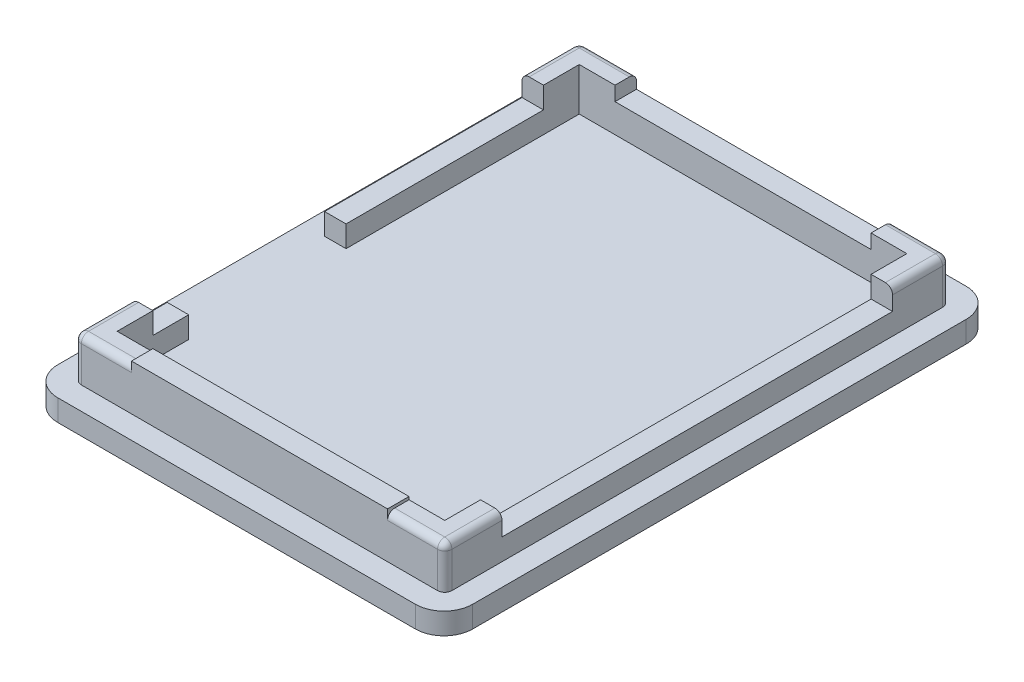
from build123d import *

# Parameters (mm, degrees)
SKETCH_1_W          = 29
SKETCH_1_H          = 38.5
EXTRUDE_2_DEPTH     = 4.5
SKETCH_3_W          = 29
SKETCH_3_H          = 38.5
SKETCH_3_W_2        = 25.9
SKETCH_3_H_2        = 35.3
CUT_EXTRUDE_1_DEPTH = 3
SKETCH_4_W          = 22.9
SKETCH_4_H          = 32.3
CUT_EXTRUDE_2_DEPTH = 3
SKETCH_5_W          = 17.9
SKETCH_5_H          = 1.5
CUT_EXTRUDE_3_DEPTH = 1
SKETCH_6_W          = 1.5
SKETCH_6_H          = 27.3
CUT_EXTRUDE_5_DEPTH = 1.5
FILLET_1_R          = 2
FILLET_5_R          = 0.5
SKETCH_8_W          = 17.9
SKETCH_8_H          = 1.5
EXTRUDE_7_DEPTH     = 0.2
FILLET_6_R          = 0.5
SKETCH_10_W         = 1.5
SKETCH_10_H         = 11
CUT_EXTRUDE_6_DEPTH = 1.5


with BuildPart() as part:
    # 草图1 → 凸台-拉伸2 (new body)
    with BuildSketch(Plane(origin=(0, 0, 0), x_dir=(1, 0, 0), z_dir=(0, 1, 0))):
        with Locations((14.5, -19.25)):
            Rectangle(SKETCH_1_W, SKETCH_1_H)
    extrude(amount=EXTRUDE_2_DEPTH)

    # 草图3 → 切除-拉伸1 (cut)
    with BuildSketch(Plane(origin=(0, 4.5, 0), x_dir=(1, 0, 0), z_dir=(0, 1, 0))):
        with Locations((14.5, -19.25)):
            Rectangle(SKETCH_3_W, SKETCH_3_H)
        with Locations((14.5, -19.25)):
            Rectangle(SKETCH_3_W_2, SKETCH_3_H_2, mode=Mode.SUBTRACT)
    extrude(amount=-CUT_EXTRUDE_1_DEPTH, mode=Mode.SUBTRACT)

    # 草图4 → 切除-拉伸2 (cut)
    with BuildSketch(Plane(origin=(0, 4.5, 0), x_dir=(1, 0, 0), z_dir=(0, 1, 0))):
        with Locations((14.5, -19.25)):
            Rectangle(SKETCH_4_W, SKETCH_4_H)
    extrude(amount=-CUT_EXTRUDE_2_DEPTH, mode=Mode.SUBTRACT)

    # 草图5 → 切除-拉伸3 (cut)
    with BuildSketch(Plane(origin=(0, 4.5, 0), x_dir=(1, 0, 0), z_dir=(0, 1, 0))):
        with Locations((14.5, -2.35)):
            Rectangle(SKETCH_5_W, SKETCH_5_H)
    extrude(amount=-CUT_EXTRUDE_3_DEPTH, mode=Mode.SUBTRACT)

    # 草图6 → 切除-拉伸5 (cut)
    with BuildSketch(Plane(origin=(0, 4.5, 0), x_dir=(1, 0, 0), z_dir=(0, 1, 0))):
        with Locations((2.3, -19.25)):
            Rectangle(SKETCH_6_W, SKETCH_6_H)
        with Locations((26.7, -19.25)):
            Rectangle(SKETCH_6_W, SKETCH_6_H)
    extrude(amount=-CUT_EXTRUDE_5_DEPTH, mode=Mode.SUBTRACT)

    # 圆角1
    fillet_1_edges = [part.edges().sort_by_distance(p)[0] for p in [
        (0, 0.75, 0),
        (29, 0.75, 0),
        (29, 0.75, 38.5),
        (0, 0.75, 38.5),
    ]]
    fillet(fillet_1_edges, radius=FILLET_1_R)

    # 圆角5
    fillet_5_edges = [part.edges().sort_by_distance(p)[0] for p in [
        (1.55, 3, 1.6),
        (27.45, 3, 1.6),
        (27.45, 3, 36.9),
        (1.55, 3, 36.9),
    ]]
    fillet(fillet_5_edges, radius=FILLET_5_R)

    # 草图8 → 凸台-拉伸7 (add)
    with BuildSketch(Plane(origin=(0, 4.5, 0), x_dir=(1, 0, 0), z_dir=(0, 1, 0))):
        with Locations((14.5, -36.15)):
            Rectangle(SKETCH_8_W, SKETCH_8_H)
    extrude(amount=EXTRUDE_7_DEPTH)

    # 圆角6
    fillet_6_edges = [part.edges().sort_by_distance(p)[0] for p in [
        (27.45, 4.5, 34.65),
        (25.2, 4.5, 1.6),
        (27.303553391, 4.5, 1.746446609),
        (1.55, 4.5, 3.85),
        (1.696446609, 4.5, 1.746446609),
        (3.8, 4.5, 36.9),
        (27.303553391, 4.5, 36.753553391),
        (1.696446609, 4.5, 36.753553391),
        (25.2, 4.5, 36.9),
        (3.8, 4.5, 1.6),
        (1.55, 4.5, 34.65),
        (27.45, 4.5, 3.85),
    ]]
    fillet(fillet_6_edges, radius=FILLET_6_R)

    # 草图10 → 切除-拉伸6 (cut)
    with BuildSketch(Plane(origin=(0, 3, 0), x_dir=(1, 0, 0), z_dir=(0, 1, 0))):
        with Locations((2.3, -24.9)):
            Rectangle(SKETCH_10_W, SKETCH_10_H)
    extrude(amount=-CUT_EXTRUDE_6_DEPTH, mode=Mode.SUBTRACT)


solid = part.part
